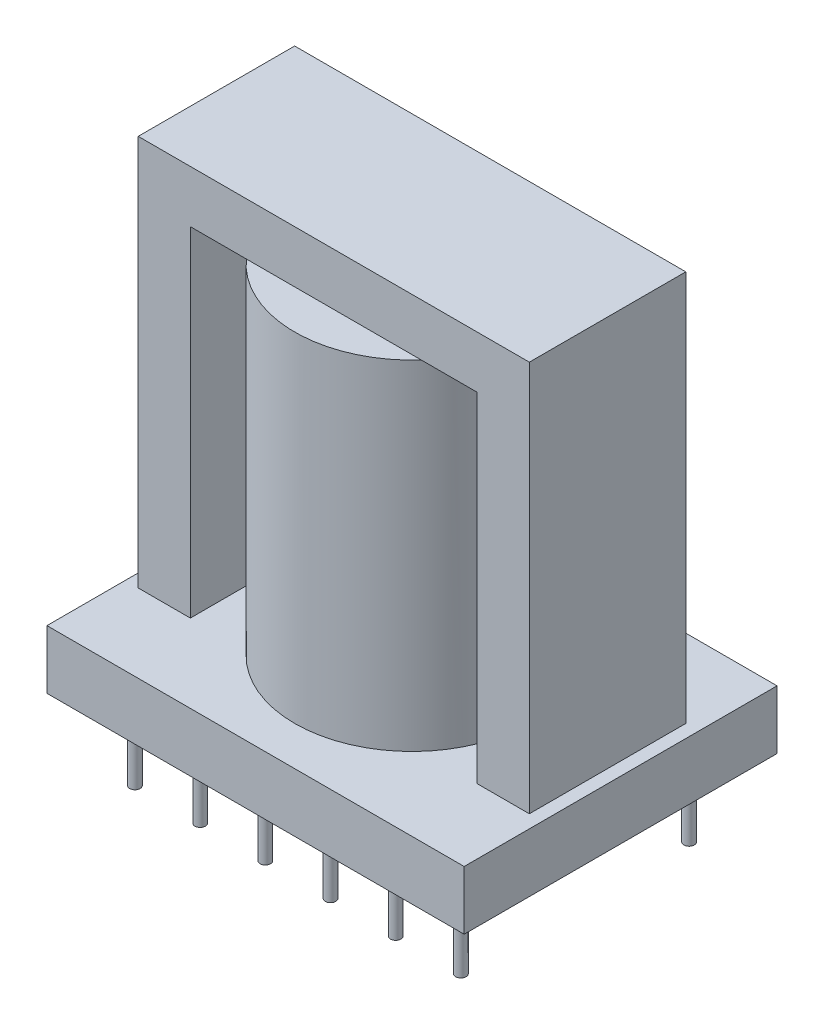
from build123d import *

# Parameters (mm, degrees)
SKETCH_1_W      = 32
SKETCH_1_H      = 24
EXTRUDE_1_DEPTH = 4.5
SKETCH_2_R      = 9
SKETCH_2_W      = 4
SKETCH_2_H      = 12
EXTRUDE_2_DEPTH = 26
SKETCH_3_W      = 30
SKETCH_3_H      = 12
EXTRUDE_3_DEPTH = 4
SKETCH_4_R      = 0.4
EXTRUDE_4_DEPTH = 6


with BuildPart() as part:
    # 스케치1 → 보스-돌출1 (new body)
    with BuildSketch(Plane(origin=(0, 0, 0), x_dir=(1, 0, 0), z_dir=(0, 1, 0))):
        Rectangle(SKETCH_1_W, SKETCH_1_H)
    extrude(amount=EXTRUDE_1_DEPTH)

    # 스케치2 → 보스-돌출2 (add)
    with BuildSketch(Plane(origin=(0, 4.5, 0), x_dir=(1, 0, 0), z_dir=(0, 1, 0))):
        with Locations(Location((0, 0, 0), (0, 0, 90))):
            Circle(SKETCH_2_R)
        with Locations((-13, 0)):
            Rectangle(SKETCH_2_W, SKETCH_2_H)
        with Locations((13, 0)):
            Rectangle(SKETCH_2_W, SKETCH_2_H)
    extrude(amount=EXTRUDE_2_DEPTH)

    # 스케치3 → 보스-돌출3 (add)
    with BuildSketch(Plane(origin=(0, 30.5, 0), x_dir=(1, 0, 0), z_dir=(0, 1, 0))):
        Rectangle(SKETCH_3_W, SKETCH_3_H)
    extrude(amount=EXTRUDE_3_DEPTH)

    # 스케치4 → 보스-돌출4 (add)
    with BuildSketch(Plane.XZ):
        with Locations(Location((2.5, -8.75, 0), (0, 0, 90))):
            Circle(SKETCH_4_R)
        with Locations(Location((7.5, -8.75, 0), (0, 0, 90))):
            Circle(SKETCH_4_R)
        with Locations(Location((12.5, -8.75, 0), (0, 0, 90))):
            Circle(SKETCH_4_R)
        with Locations(Location((-12.5, -8.75, 0), (0, 0, 90))):
            Circle(SKETCH_4_R)
        with Locations(Location((-7.5, -8.75, 0), (0, 0, 90))):
            Circle(SKETCH_4_R)
        with Locations(Location((-2.5, -8.75, 0), (0, 0, 90))):
            Circle(SKETCH_4_R)
        with Locations(Location((-2.5, 8.75, 0), (0, 0, 90))):
            Circle(SKETCH_4_R)
        with Locations(Location((-7.5, 8.75, 0), (0, 0, 90))):
            Circle(SKETCH_4_R)
        with Locations(Location((-12.5, 8.75, 0), (0, 0, 90))):
            Circle(SKETCH_4_R)
        with Locations(Location((12.5, 8.75, 0), (0, 0, 90))):
            Circle(SKETCH_4_R)
        with Locations(Location((7.5, 8.75, 0), (0, 0, 90))):
            Circle(SKETCH_4_R)
        with Locations(Location((2.5, 8.75, 0), (0, 0, 90))):
            Circle(SKETCH_4_R)
    extrude(amount=EXTRUDE_4_DEPTH)


solid = part.part
